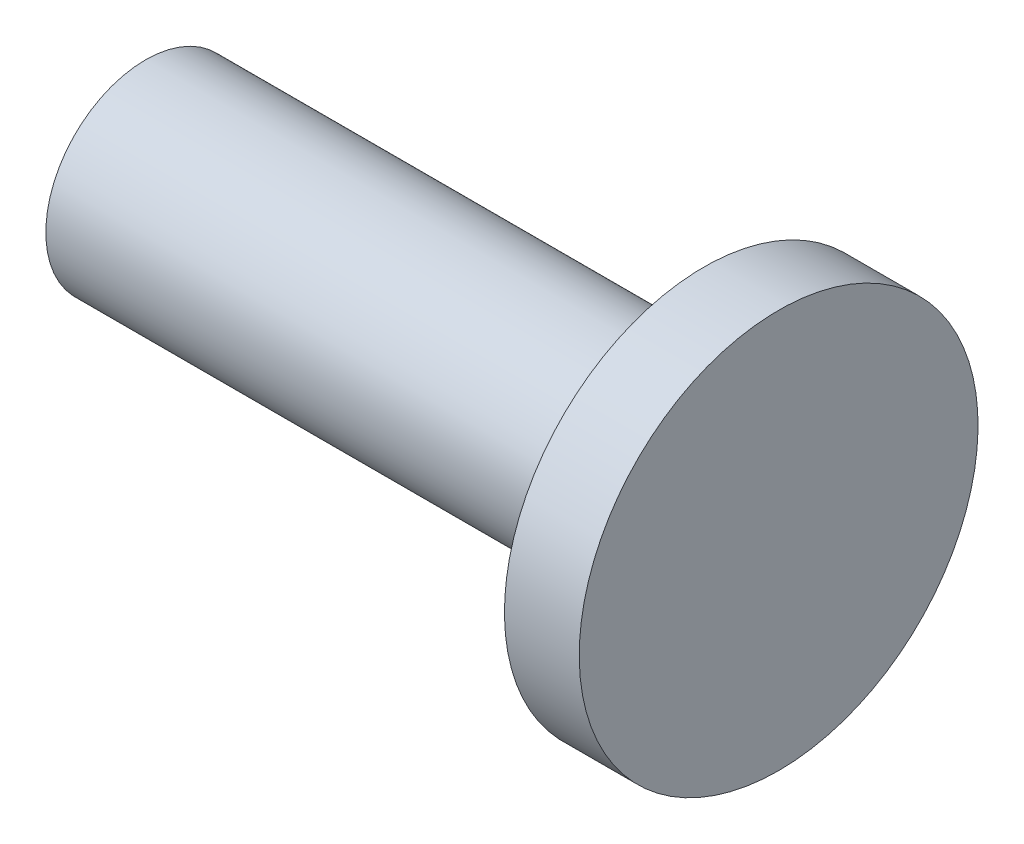
from build123d import *


with BuildPart() as part:
    # Sketch2 → Revolve1 (revolve)
    with BuildSketch(Plane.XY, mode=Mode.PRIVATE) as revolve1_sk:
        Polygon((-56, 10), (0, 10), (0, 20), (7.5, 20), (7.5, 0), (-56, 0), align=None)
    revolve(revolve1_sk.sketch.rotate(Axis((-72.450046798, 0, 0), (1, 0, 0)), 180), axis=Axis((-72.450046798, 0, 0), (1, 0, 0)))


solid = part.part
